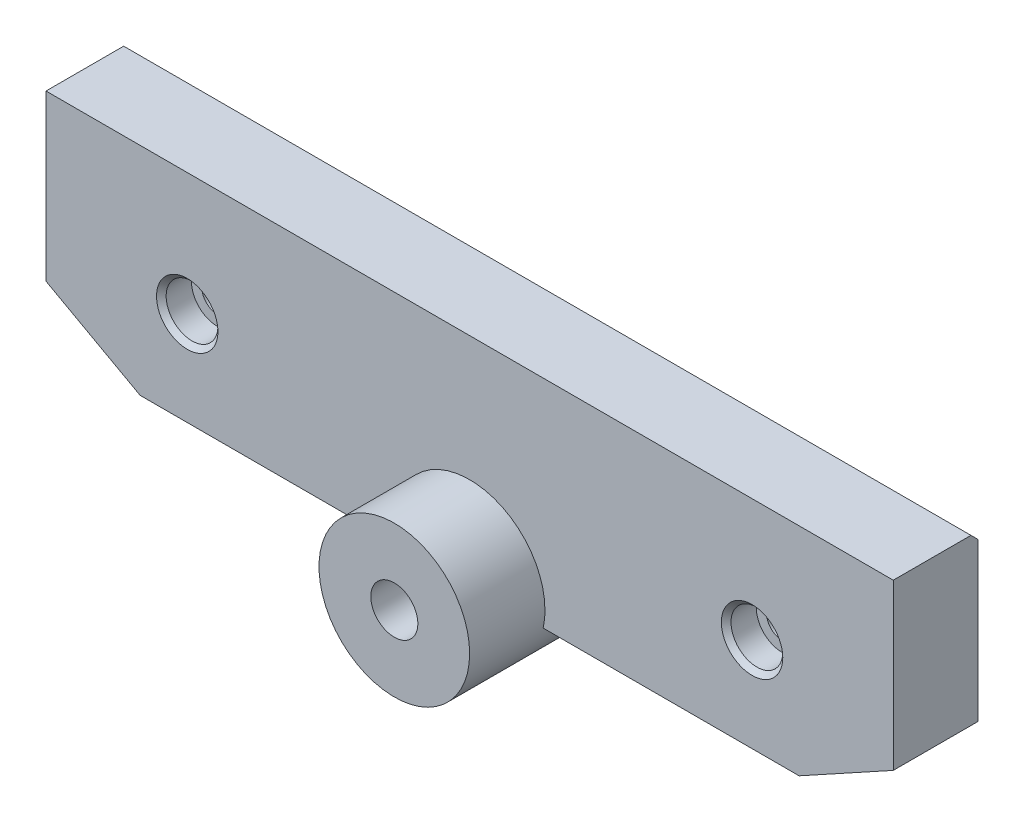
from build123d import *

# Parameters (mm, degrees)
SKETCH1_W                                    = 180
SKETCH1_H                                    = 46
BOSS_EXTRUDE1_DEPTH                          = 18
CUT_EXTRUDE1_DEPTH                           = 95.620293806
CUT_EXTRUDE1_DEPTH_BACK                      = 18
CUT_EXTRUDE2_DEPTH                           = 95.620293806
CUT_EXTRUDE2_DEPTH_BACK                      = 18
SKETCH4_R                                    = 16
BOSS_EXTRUDE2_DEPTH                          = 18
BOSS_EXTRUDE3_START                          = 16
SKETCH5_R                                    = 16
BOSS_EXTRUDE3_DEPTH                          = 16
SKETCH6_R                                    = 5
CUT_EXTRUDE3_DEPTH                           = 103.548768886
CBORE_FOR_M6_HEX_SOCKET_HEAD_CAP_SCR_2_COUNT = 2
CBORE_FOR_M6_HEX_SOCKET_HEAD_CAP_SCR_2_PITCH = 120
CHAMFER1_SIZE                                = 1.5


with BuildPart() as part:
    # Sketch1 → Boss-Extrude1 (new body)
    with BuildSketch(Plane.XY):
        Rectangle(SKETCH1_W, SKETCH1_H)
    extrude(amount=BOSS_EXTRUDE1_DEPTH)

    # Sketch2 → Cut-Extrude1 (cut, two sides: drawn at the far end of the back side and taken through both)
    with BuildSketch(Plane.XY.offset(18).offset(-CUT_EXTRUDE1_DEPTH_BACK)):
        Polygon((-420.107698739, 169.559234306), (-90, -12), (-70, -23), (260.107698739, -204.559234306), (-103.010769874, -864.774631783), (-783.226167351, -490.656163171), align=None)
    extrude(amount=CUT_EXTRUDE1_DEPTH + CUT_EXTRUDE1_DEPTH_BACK, mode=Mode.SUBTRACT)

    # Sketch3 → Cut-Extrude2 (cut, two sides: drawn at the far end of the back side and taken through both)
    with BuildSketch(Plane.XY.offset(18).offset(-CUT_EXTRUDE2_DEPTH_BACK)):
        Polygon((420.107698739, 169.559234306), (90, -12), (70, -23), (-260.107698739, -204.559234306), (103.010769874, -864.774631783), (783.226167351, -490.656163171), align=None)
    extrude(amount=CUT_EXTRUDE2_DEPTH + CUT_EXTRUDE2_DEPTH_BACK, mode=Mode.SUBTRACT)

    # Sketch4 → Boss-Extrude2 (add)
    with BuildSketch(Plane.XY.offset(18)):
        with Locations((0, -19.5)):
            Circle(SKETCH4_R)
    extrude(amount=-BOSS_EXTRUDE2_DEPTH)

    # Sketch5 → Boss-Extrude3 (add)
    with BuildSketch(Plane.XY.offset(18).offset(BOSS_EXTRUDE3_START)):
        with Locations((0, -19.5)):
            Circle(SKETCH5_R)
    extrude(amount=-BOSS_EXTRUDE3_DEPTH)

    # Sketch6 → Cut-Extrude3 (cut, through all)
    with BuildSketch(Plane.XY.offset(34)):
        with Locations((0, -19.5)):
            Circle(SKETCH6_R)
    extrude(amount=-CUT_EXTRUDE3_DEPTH, mode=Mode.SUBTRACT)

    # Sketch8 → CBORE for M6 Hex Socket Head Cap Screw1 (revolve, cut)
    with BuildSketch(Plane(origin=(-60, -3, 18), x_dir=(0, -1, 0), z_dir=(1, 0, 0))):
        Polygon((0, 0), (0, 18), (3.3, 18), (3.3, 6.4), (5.5, 6.4), (5.5, 1.025), (6.525, 0), align=None)
    cbore_for_m6_hex_socket_head_cap_screw1 = revolve(axis=Axis((-60, -3, 24.35), (0, 0, -1)), mode=Mode.SUBTRACT)

    # CBORE for M6 Hex Socket Head Cap Scr 2: CBORE for M6 Hex Socket Head Cap Screw1 ×2
    with Locations(*[(i * CBORE_FOR_M6_HEX_SOCKET_HEAD_CAP_SCR_2_PITCH, 0, 0) for i in range(1, CBORE_FOR_M6_HEX_SOCKET_HEAD_CAP_SCR_2_COUNT)]):
        add(cbore_for_m6_hex_socket_head_cap_screw1, mode=Mode.SUBTRACT)

    # Chamfer1
    chamfer1_edges = [part.edges().sort_by_distance(p)[0] for p in [
        (0, 23, 0),
    ]]
    chamfer(chamfer1_edges, length=CHAMFER1_SIZE)


solid = part.part
